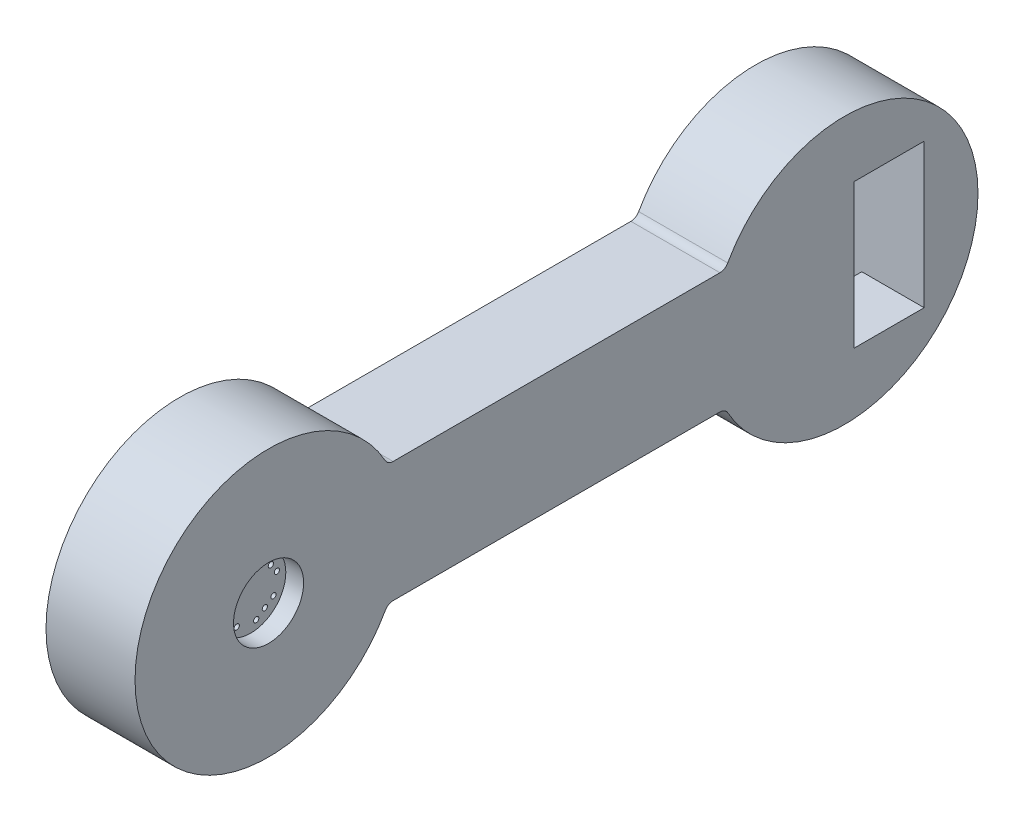
from build123d import *

# Parameters (mm, degrees)
BOSS_EXTRUDE1_DEPTH = 25.4
FILLET1_R           = 2.54
SKETCH2_R           = 10
CUT_EXTRUDE2_DEPTH  = 5.08
CUT_EXTRUDE3_REACH  = 209.515
SKETCH6_W           = 20.066
SKETCH6_H           = 41.148
SKETCH9_W           = 20.066
SKETCH9_H           = 6.35
CUT_EXTRUDE6_DEPTH  = 7.62
FILLET2_R           = 1.27
CUT_EXTRUDE7_REACH  = 209.515
SKETCH10_R          = 0.75


with BuildPart() as part:
    # Sketch1 → Boss-Extrude1 (new body)
    with BuildSketch(Plane(origin=(0, 0, 0), x_dir=(0, 0, -1), z_dir=(1, 0, 0))):
        with BuildLine():
            Line((33.997808163, 17.197646354), (130.301908565, 17.197646354))
            ThreePointArc((130.301908565, 17.197646354), (202.399716728, 0), (130.301908565, -17.197646354))
            Line((130.301908565, -17.197646354), (33.997808163, -17.197646354))
            ThreePointArc((33.997808163, -17.197646354), (-38.1, 0), (33.997808163, 17.197646354))
        make_face()
    extrude(amount=BOSS_EXTRUDE1_DEPTH)

    # Fillet1
    fillet1_edges = [part.edges().sort_by_distance(p)[0] for p in [
        (12.7, 17.197646354, -33.997808163),
        (12.7, 17.197646354, -130.301908565),
        (12.7, -17.197646354, -130.301908565),
        (12.7, -17.197646354, -33.997808163),
    ]]
    fillet(fillet1_edges, radius=FILLET1_R)

    # Sketch2 → Cut-Extrude2 (cut)
    with BuildSketch(Plane(origin=(25.4, 0, 0), x_dir=(0, 0, -1), z_dir=(1, 0, 0))):
        Circle(SKETCH2_R)
    extrude(amount=-CUT_EXTRUDE2_DEPTH, mode=Mode.SUBTRACT)

    # Sketch6 → Cut-Extrude3 (cut, up to next)
    with BuildSketch(Plane(origin=(25.4, 0, 0), x_dir=(0, 0, -1), z_dir=(1, 0, 0)), mode=Mode.PRIVATE) as cut_extrude3_sk1:
        with Locations((176.999716728, 0)):
            Rectangle(SKETCH6_W, SKETCH6_H)
    cut_extrude3_tool1 = extrude(cut_extrude3_sk1.sketch, amount=-CUT_EXTRUDE3_REACH, mode=Mode.PRIVATE) & part.part
    add(cut_extrude3_tool1.solids().sort_by_distance((25.4, 0, -176.999717))[0], mode=Mode.SUBTRACT)

    # Sketch9 → Cut-Extrude6 (cut)
    with BuildSketch(Plane.ZY):
        with Locations((-176.999716728, -23.749)):
            Rectangle(SKETCH9_W, SKETCH9_H)
    extrude(amount=-CUT_EXTRUDE6_DEPTH, mode=Mode.SUBTRACT)

    # Fillet2
    fillet2_edges = [part.edges().sort_by_distance(p)[0] for p in [
        (7.62, -26.924, -176.999716728),
        (0, -26.924, -176.999716728),
    ]]
    fillet(fillet2_edges, radius=FILLET2_R)

    # Sketch10 → Cut-Extrude7 (cut, up to next)
    with BuildSketch(Plane.ZY, mode=Mode.PRIVATE) as cut_extrude7_sk1:
        with Locations((-4.019820442, -5.730710568)):
            Circle(SKETCH10_R)
    cut_extrude7_tool1 = extrude(cut_extrude7_sk1.sketch, amount=-CUT_EXTRUDE7_REACH, mode=Mode.PRIVATE) & part.part
    # Sketch10 → Cut-Extrude7 (cut, up to next)
    with BuildSketch(Plane.ZY, mode=Mode.PRIVATE) as cut_extrude7_sk2:
        with Locations((-6.475839257, -4.007930379)):
            Circle(SKETCH10_R)
    cut_extrude7_tool2 = extrude(cut_extrude7_sk2.sketch, amount=-CUT_EXTRUDE7_REACH, mode=Mode.PRIVATE) & part.part
    # Sketch10 → Cut-Extrude7 (cut, up to next)
    with BuildSketch(Plane.ZY, mode=Mode.PRIVATE) as cut_extrude7_sk3:
        with Locations((-1.563801627, -7.453490757)):
            Circle(SKETCH10_R)
    cut_extrude7_tool3 = extrude(cut_extrude7_sk3.sketch, amount=-CUT_EXTRUDE7_REACH, mode=Mode.PRIVATE) & part.part
    # Sketch10 → Cut-Extrude7 (cut, up to next)
    with BuildSketch(Plane.ZY, mode=Mode.PRIVATE) as cut_extrude7_sk4:
        with Locations((4.007930379, -6.475839257)):
            Circle(SKETCH10_R)
    cut_extrude7_tool4 = extrude(cut_extrude7_sk4.sketch, amount=-CUT_EXTRUDE7_REACH, mode=Mode.PRIVATE) & part.part
    # Sketch10 → Cut-Extrude7 (cut, up to next)
    with BuildSketch(Plane.ZY, mode=Mode.PRIVATE) as cut_extrude7_sk5:
        with Locations((5.730710568, -4.019820442)):
            Circle(SKETCH10_R)
    cut_extrude7_tool5 = extrude(cut_extrude7_sk5.sketch, amount=-CUT_EXTRUDE7_REACH, mode=Mode.PRIVATE) & part.part
    # Sketch10 → Cut-Extrude7 (cut, up to next)
    with BuildSketch(Plane.ZY, mode=Mode.PRIVATE) as cut_extrude7_sk6:
        with Locations((7.453490757, -1.563801627)):
            Circle(SKETCH10_R)
    cut_extrude7_tool6 = extrude(cut_extrude7_sk6.sketch, amount=-CUT_EXTRUDE7_REACH, mode=Mode.PRIVATE) & part.part
    # Sketch10 → Cut-Extrude7 (cut, up to next)
    with BuildSketch(Plane.ZY, mode=Mode.PRIVATE) as cut_extrude7_sk7:
        with Locations((6.475839257, 4.007930379)):
            Circle(SKETCH10_R)
    cut_extrude7_tool7 = extrude(cut_extrude7_sk7.sketch, amount=-CUT_EXTRUDE7_REACH, mode=Mode.PRIVATE) & part.part
    # Sketch10 → Cut-Extrude7 (cut, up to next)
    with BuildSketch(Plane.ZY, mode=Mode.PRIVATE) as cut_extrude7_sk8:
        with Locations((4.019820442, 5.730710568)):
            Circle(SKETCH10_R)
    cut_extrude7_tool8 = extrude(cut_extrude7_sk8.sketch, amount=-CUT_EXTRUDE7_REACH, mode=Mode.PRIVATE) & part.part
    # Sketch10 → Cut-Extrude7 (cut, up to next)
    with BuildSketch(Plane.ZY, mode=Mode.PRIVATE) as cut_extrude7_sk9:
        with Locations((1.563801627, 7.453490757)):
            Circle(SKETCH10_R)
    cut_extrude7_tool9 = extrude(cut_extrude7_sk9.sketch, amount=-CUT_EXTRUDE7_REACH, mode=Mode.PRIVATE) & part.part
    # Sketch10 → Cut-Extrude7 (cut, up to next)
    with BuildSketch(Plane.ZY, mode=Mode.PRIVATE) as cut_extrude7_sk10:
        with Locations((-4.007930379, 6.475839257)):
            Circle(SKETCH10_R)
    cut_extrude7_tool10 = extrude(cut_extrude7_sk10.sketch, amount=-CUT_EXTRUDE7_REACH, mode=Mode.PRIVATE) & part.part
    # Sketch10 → Cut-Extrude7 (cut, up to next)
    with BuildSketch(Plane.ZY, mode=Mode.PRIVATE) as cut_extrude7_sk11:
        with Locations((-5.730710568, 4.019820442)):
            Circle(SKETCH10_R)
    cut_extrude7_tool11 = extrude(cut_extrude7_sk11.sketch, amount=-CUT_EXTRUDE7_REACH, mode=Mode.PRIVATE) & part.part
    # Sketch10 → Cut-Extrude7 (cut, up to next)
    with BuildSketch(Plane.ZY, mode=Mode.PRIVATE) as cut_extrude7_sk12:
        with Locations((-7.453490757, 1.563801627)):
            Circle(SKETCH10_R)
    cut_extrude7_tool12 = extrude(cut_extrude7_sk12.sketch, amount=-CUT_EXTRUDE7_REACH, mode=Mode.PRIVATE) & part.part
    add(cut_extrude7_tool1.solids().sort_by_distance((0, -5.730711, -4.01982))[0], mode=Mode.SUBTRACT)
    add(cut_extrude7_tool2.solids().sort_by_distance((0, -4.00793, -6.475839))[0], mode=Mode.SUBTRACT)
    add(cut_extrude7_tool3.solids().sort_by_distance((0, -7.453491, -1.563802))[0], mode=Mode.SUBTRACT)
    add(cut_extrude7_tool4.solids().sort_by_distance((0, -6.475839, 4.00793))[0], mode=Mode.SUBTRACT)
    add(cut_extrude7_tool5.solids().sort_by_distance((0, -4.01982, 5.730711))[0], mode=Mode.SUBTRACT)
    add(cut_extrude7_tool6.solids().sort_by_distance((0, -1.563802, 7.453491))[0], mode=Mode.SUBTRACT)
    add(cut_extrude7_tool7.solids().sort_by_distance((0, 4.00793, 6.475839))[0], mode=Mode.SUBTRACT)
    add(cut_extrude7_tool8.solids().sort_by_distance((0, 5.730711, 4.01982))[0], mode=Mode.SUBTRACT)
    add(cut_extrude7_tool9.solids().sort_by_distance((0, 7.453491, 1.563802))[0], mode=Mode.SUBTRACT)
    add(cut_extrude7_tool10.solids().sort_by_distance((0, 6.475839, -4.00793))[0], mode=Mode.SUBTRACT)
    add(cut_extrude7_tool11.solids().sort_by_distance((0, 4.01982, -5.730711))[0], mode=Mode.SUBTRACT)
    add(cut_extrude7_tool12.solids().sort_by_distance((0, 1.563802, -7.453491))[0], mode=Mode.SUBTRACT)


solid = part.part
